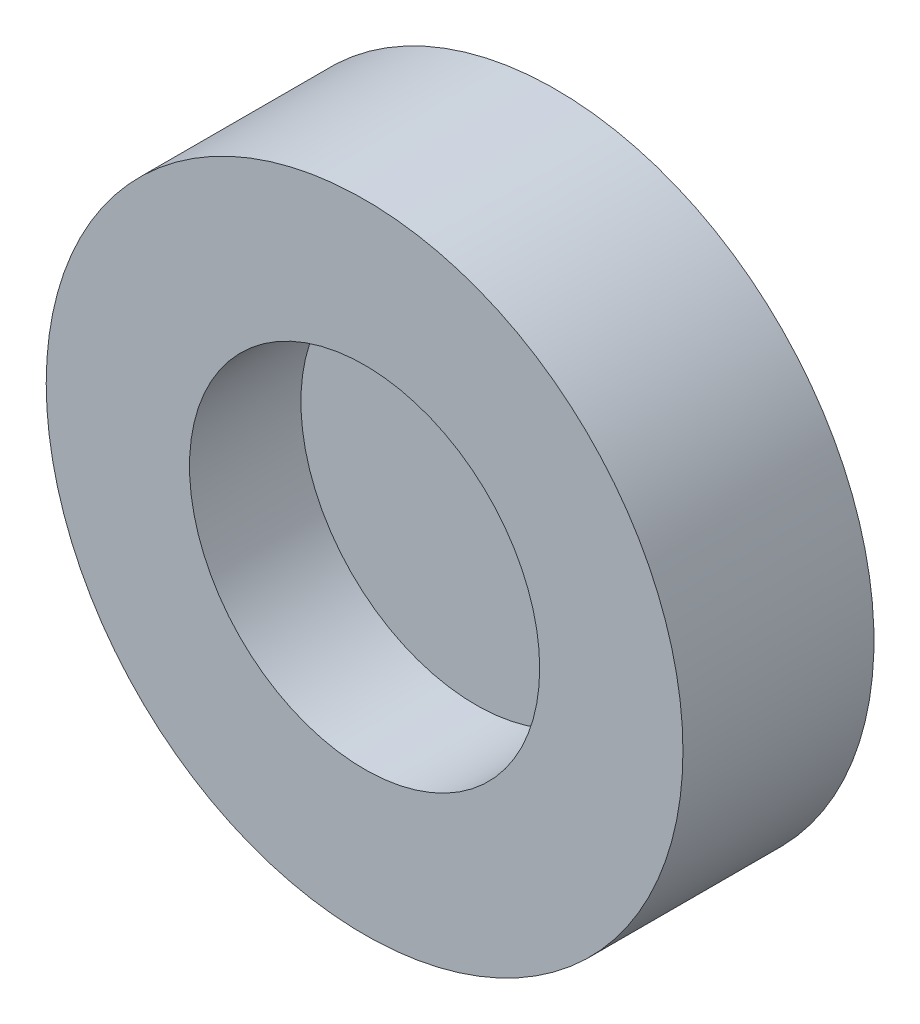
from build123d import *

# Parameters (mm, degrees)
SKETCH1_R           = 20
SKETCH1_R_2         = 11
BOSS_EXTRUDE1_DEPTH = 7
BOSS_EXTRUDE2_START = 5
SKETCH2_R           = 20
BOSS_EXTRUDE2_DEPTH = 5


with BuildPart() as part:
    # Sketch1 → Boss-Extrude1 (new body)
    with BuildSketch(Plane.XY):
        Circle(SKETCH1_R)
        Circle(SKETCH1_R_2, mode=Mode.SUBTRACT)
    extrude(amount=BOSS_EXTRUDE1_DEPTH)

    # Sketch2 → Boss-Extrude2 (add)
    with BuildSketch(Plane(origin=(0, 0, 0), x_dir=(-1, 0, 0), z_dir=(0, 0, -1)).offset(BOSS_EXTRUDE2_START)):
        Circle(SKETCH2_R)
    extrude(amount=-BOSS_EXTRUDE2_DEPTH)


solid = part.part
